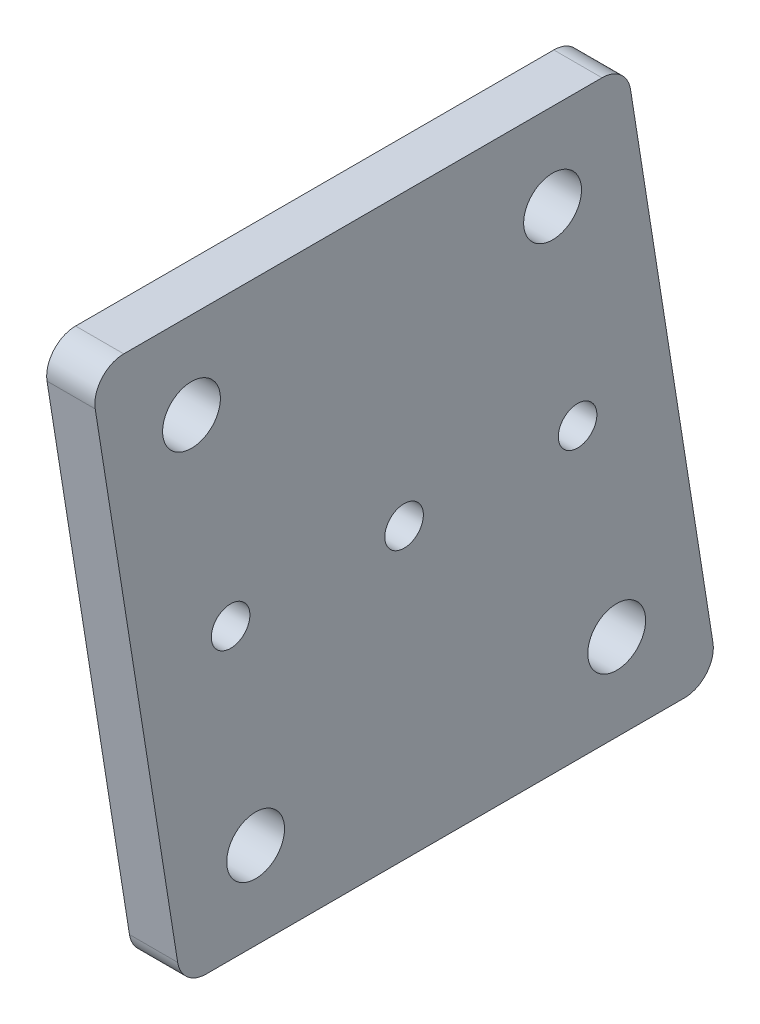
from build123d import *

# Parameters (mm, degrees)
SKETCH1_R           = 3
SKETCH1_R_2         = 2
BOSS_EXTRUDE1_DEPTH = 5
FILLET1_R           = 3


with BuildPart() as part:
    # Sketch1 → Boss-Extrude1 (new body)
    with BuildSketch(Plane(origin=(0, 0, 0), x_dir=(0, 0, -1), z_dir=(1, 0, 0))):
        Polygon((-7.686726169, -9), (47.998855749, -9), (38.49578933, 51), (-17.189792589, 51), align=None)
        Circle(SKETCH1_R, mode=Mode.SUBTRACT)
        with Locations((37.461209654, 0)):
            Circle(SKETCH1_R, mode=Mode.SUBTRACT)
        with Locations((-6.652146494, 42)):
            Circle(SKETCH1_R, mode=Mode.SUBTRACT)
        with Locations((30.809063161, 42)):
            Circle(SKETCH1_R, mode=Mode.SUBTRACT)
        with Locations((15.40453158, 21)):
            Circle(SKETCH1_R_2, mode=Mode.SUBTRACT)
        with Locations((-2.59546842, 21)):
            Circle(SKETCH1_R_2, mode=Mode.SUBTRACT)
        with Locations((33.40453158, 21)):
            Circle(SKETCH1_R_2, mode=Mode.SUBTRACT)
    extrude(amount=BOSS_EXTRUDE1_DEPTH)

    # Fillet1
    fillet1_edges = [part.edges().sort_by_distance(p)[0] for p in [
        (2.5, 51, 17.189792589),
        (2.5, 51, -38.49578933),
        (2.5, -9, -47.998855749),
        (2.5, -9, 7.686726169),
    ]]
    fillet(fillet1_edges, radius=FILLET1_R)


solid = part.part
